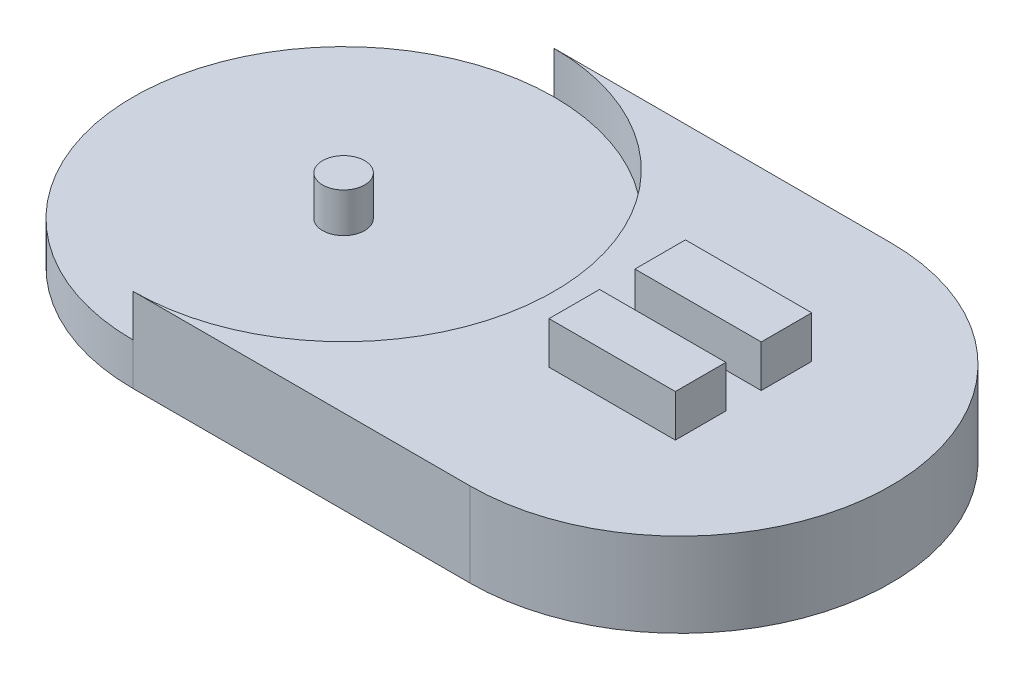
from build123d import *

# Parameters (mm, degrees)
EXTRUDE_1_DEPTH     = 10
CUT_EXTRUDE_START   = -5
SKETCH_2_R          = 25
CUT_EXTRUDE_1_DEPTH = 5
SKETCH_3_R          = 2.5
EXTRUDE_2_DEPTH     = 4.7
SKETCH_4_W          = 15
SKETCH_4_H          = 6
EXTRUDE_3_DEPTH     = 5


with BuildPart() as part:
    # 草圖1 → 填料-伸長1 (new body)
    with BuildSketch(Plane(origin=(0, 0, 0), x_dir=(1, 0, 0), z_dir=(0, 1, 0))):
        with BuildLine():
            Line((0, 25), (40, 25))
            ThreePointArc((40, 25), (65, 0), (40, -25))
            Line((40, -25), (0, -25))
            ThreePointArc((0, -25), (-25, 0), (0, 25))
        make_face()
    extrude(amount=EXTRUDE_1_DEPTH)

    # 草圖2 → 除料-伸長1 (cut)
    with BuildSketch(Plane(origin=(0, 10, 0), x_dir=(1, 0, 0), z_dir=(0, 1, 0)).offset(CUT_EXTRUDE_START)):
        Circle(SKETCH_2_R)
    extrude(amount=CUT_EXTRUDE_1_DEPTH, mode=Mode.SUBTRACT)

    # 草圖3 → 填料-伸長2 (add)
    with BuildSketch(Plane(origin=(0, 5, 0), x_dir=(1, 0, 0), z_dir=(0, 1, 0))):
        with Locations(Location((0, 0, 0), (0, 0, 270))):
            Circle(SKETCH_3_R)
    extrude(amount=EXTRUDE_2_DEPTH)

    # 草圖4 → 填料-伸長3 (add)
    with BuildSketch(Plane(origin=(0, 10, 0), x_dir=(1, 0, 0), z_dir=(0, 1, 0))):
        with Locations((40, 5.1)):
            Rectangle(SKETCH_4_W, SKETCH_4_H)
        with Locations((40, -5.1)):
            Rectangle(SKETCH_4_W, SKETCH_4_H)
    extrude(amount=EXTRUDE_3_DEPTH)


solid = part.part
